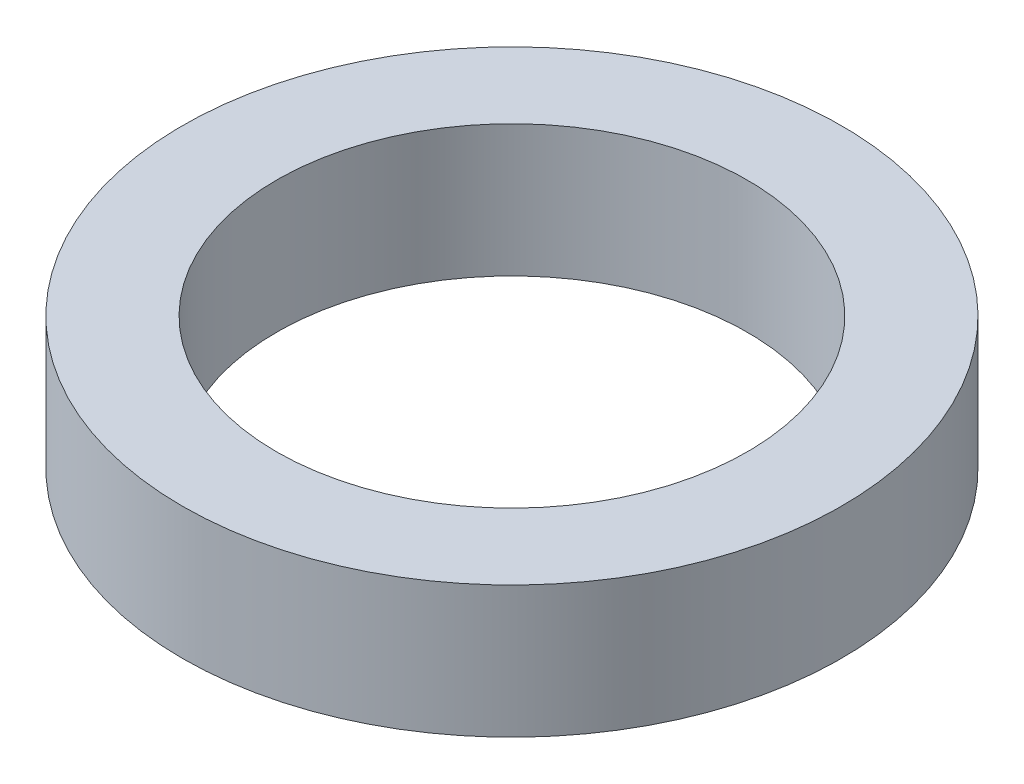
from build123d import *

# Parameters (mm, degrees)
SKETCH_1_R      = 35
SKETCH_1_R_2    = 25
EXTRUDE_1_DEPTH = 14


with BuildPart() as part:
    # 草图1 → 凸台-拉伸1 (new body)
    with BuildSketch(Plane(origin=(0, 0, 0), x_dir=(1, 0, 0), z_dir=(0, 1, 0))):
        with Locations(Location((0, 0, 0), (0, 0, 270))):
            Circle(SKETCH_1_R)
        with Locations(Location((0, 0, 0), (0, 0, 270))):
            Circle(SKETCH_1_R_2, mode=Mode.SUBTRACT)
    extrude(amount=EXTRUDE_1_DEPTH)


solid = part.part
